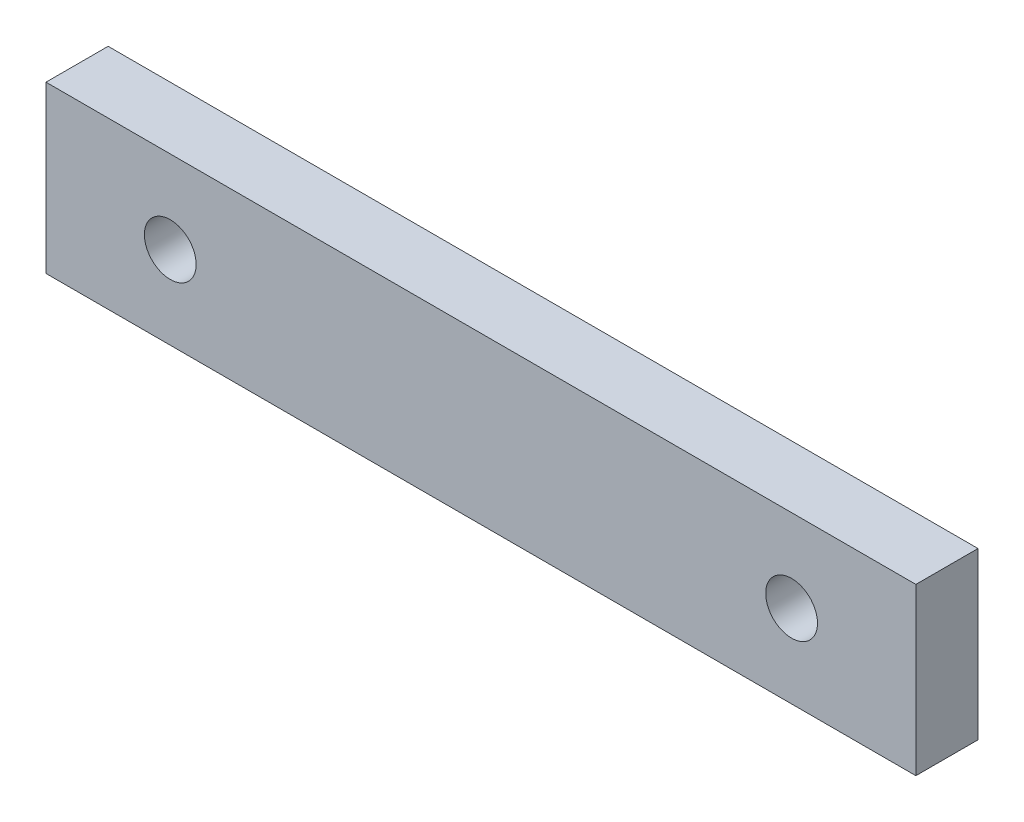
from build123d import *

# Parameters (mm, degrees)
SKETCH1_W           = 210
SKETCH1_H           = 40
BOSS_EXTRUDE1_DEPTH = 15
SKETCH2_R           = 6.25
CUT_EXTRUDE1_DEPTH  = 15


with BuildPart() as part:
    # Sketch1 → Boss-Extrude1 (new body)
    with BuildSketch(Plane.XY):
        with Locations((105, 20)):
            Rectangle(SKETCH1_W, SKETCH1_H)
    extrude(amount=BOSS_EXTRUDE1_DEPTH)

    # Sketch2 → Cut-Extrude1 (cut)
    with BuildSketch(Plane.XY.offset(15)):
        with Locations((30, 20)):
            Circle(SKETCH2_R)
        with Locations((180, 20)):
            Circle(SKETCH2_R)
    extrude(amount=-CUT_EXTRUDE1_DEPTH, mode=Mode.SUBTRACT)


solid = part.part
